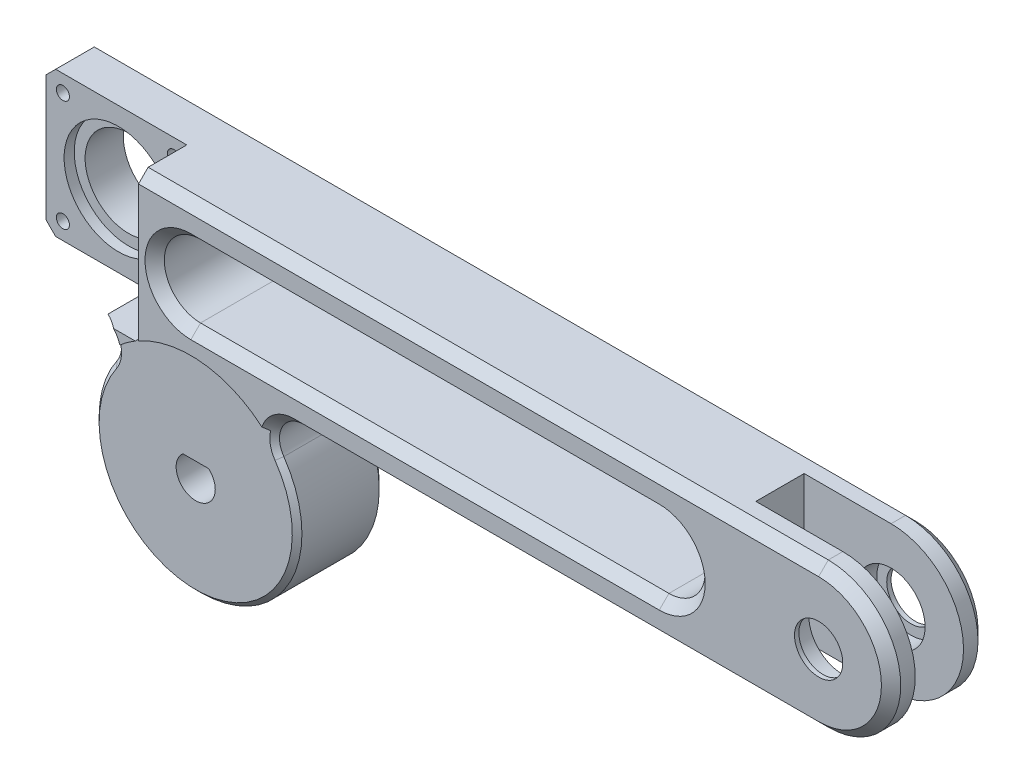
from build123d import *

# Parameters (mm, degrees)
EXTRUDE_1_DEPTH      = 20
CHAMFER_1_SIZE       = 2
SKETCH_5_R           = 5
CUT_EXTRUDE_4_DEPTH  = 5
SKETCH_3_W           = 36
SKETCH_3_H           = 10
CUT_EXTRUDE_2_DEPTH  = 200.103917213
CUT_EXTRUDE_3_DEPTH  = 195.273950902
CHAMFER_2_SIZE       = 2
CHAMFER_3_SIZE       = 2
CHAMFER_4_SIZE       = 2
CUT_EXTRUDE_START    = -20
SKETCH_8_W           = 28.3
SKETCH_8_H           = 31
CUT_EXTRUDE_5_DEPTH  = 10
SKETCH_9_R           = 11.25
CUT_EXTRUDE_6_DEPTH  = 2.1
SKETCH_9_3_R         = 1.35
CUT_EXTRUDE_7_DEPTH  = 194.500304907
CUT_EXTRUDE_8_DEPTH  = 195.273950902
SKETCH_11_W          = 21.182127439
SKETCH_11_H          = 11.878785241
CUT_EXTRUDE_9_DEPTH  = 200.103917213
SKETCH_12_R          = 9
CUT_EXTRUDE_10_DEPTH = 194.62019006
SKETCH_13_R          = 7.05
CUT_EXTRUDE_11_DEPTH = 4.1
SKETCH_14_R          = 22.5
CUT_EXTRUDE_12_DEPTH = 1


with BuildPart() as part:
    # 草图1 → 凸台-拉伸1 (new body)
    with BuildSketch(Plane.XY):
        with BuildLine():
            Line((0, 15), (170, 15))
            ThreePointArc((170, 15), (185, 0), (170, -15))
            Line((170, -15), (61.353463239, -15))
            ThreePointArc((61.353463239, -15), (56.922725161, -17.682984659), (57.247028001, -22.852575965))
            ThreePointArc((57.247028001, -22.852575965), (40, -55.833395016), (22.752971999, -22.852575965))
            ThreePointArc((22.752971999, -22.852575965), (23.077274839, -17.682984659), (18.646536761, -15))
            Line((18.646536761, -15), (0, -15))
            Line((0, -15), (0, 15))
        make_face()
    extrude(amount=EXTRUDE_1_DEPTH)

    # 倒角1
    chamfer_1_edges = [part.edges().sort_by_distance(p)[0] for p in [
        (0, -15, 10),
        (0, 15, 10),
    ]]
    chamfer(chamfer_1_edges, length=CHAMFER_1_SIZE)

    # 草图5 → 切除-拉伸4 (cut)
    with BuildSketch(Plane(origin=(0, 0, 0), x_dir=(-1, 0, 0), z_dir=(0, 0, -1))):
        with Locations((-170, 0)):
            Circle(SKETCH_5_R)
    cut_extrude_4 = extrude(amount=-CUT_EXTRUDE_4_DEPTH, mode=Mode.SUBTRACT)

    # 草图3 → 切除-拉伸2 (cut, through all)
    with BuildSketch(Plane(origin=(0, 15, 0), x_dir=(1, 0, 0), z_dir=(0, 1, 0))):
        with Locations((170, -10)):
            Rectangle(SKETCH_3_W, SKETCH_3_H)
    extrude(amount=-CUT_EXTRUDE_2_DEPTH, mode=Mode.SUBTRACT)

    # 草图4 → 切除-拉伸3 (cut, through all)
    with BuildSketch(Plane(origin=(0, 0, 0), x_dir=(-1, 0, 0), z_dir=(0, 0, -1))):
        with BuildLine():
            Line((-40, -7.5), (-137, -7.5))
            ThreePointArc((-137, -7.5), (-144.5, 0), (-137, 7.5))
            Line((-137, 7.5), (-40, 7.5))
            ThreePointArc((-40, 7.5), (-32.5, 0), (-40, -7.5))
        make_face()
    extrude(amount=-CUT_EXTRUDE_3_DEPTH, mode=Mode.SUBTRACT)

    # 倒角2
    chamfer_2_edges = [part.edges().sort_by_distance(p)[0] for p in [
        (32.5, 0, 20),
        (88.5, -7.5, 20),
        (144.5, 0, 20),
        (88.5, 7.5, 20),
        (32.5, 0, 0),
        (88.5, 7.5, 0),
        (144.5, 0, 0),
        (88.5, -7.5, 0),
    ]]
    chamfer(chamfer_2_edges, length=CHAMFER_2_SIZE)

    # 倒角3
    chamfer_3_edges = [part.edges().sort_by_distance(p)[0] for p in [
        (10.323268381, -15, 0),
        (23.077274839, -17.682984659, 0),
        (40, -55.833395016, 0),
        (56.922725161, -17.682984659, 0),
        (115.676731619, -15, 0),
        (185, 0, 0),
        (86, 15, 0),
    ]]
    chamfer(chamfer_3_edges, length=CHAMFER_3_SIZE)

    # 倒角4
    chamfer_4_edges = [part.edges().sort_by_distance(p)[0] for p in [
        (10.323268381, -15, 20),
        (23.077274839, -17.682984659, 20),
        (40, -55.833395016, 20),
        (56.922725161, -17.682984659, 20),
        (115.676731619, -15, 20),
        (185, 0, 20),
        (86, 15, 20),
    ]]
    chamfer(chamfer_4_edges, length=CHAMFER_4_SIZE)

    # 镜向1: 切除-拉伸4 across plane
    add(cut_extrude_4.mirror(Plane(origin=(0, 0, 10), x_dir=(1, 0, 0), z_dir=(0, 0, -1))), mode=Mode.SUBTRACT)

    # 草图8 → 切除-拉伸5 (cut)
    with BuildSketch(Plane(origin=(0, 0, 0), x_dir=(-1, 0, 0), z_dir=(0, 0, -1)).offset(CUT_EXTRUDE_START)):
        with Locations((-15, 0)):
            Rectangle(SKETCH_8_W, SKETCH_8_H)
    extrude(amount=CUT_EXTRUDE_5_DEPTH, mode=Mode.SUBTRACT)

    # 草图9 → 切除-拉伸6 (cut)
    with BuildSketch(Plane.XY.offset(10)):
        with Locations((15, 0)):
            Circle(SKETCH_9_R)
    extrude(amount=-CUT_EXTRUDE_6_DEPTH, mode=Mode.SUBTRACT)

    # 草图9<3> → 切除-拉伸7 (cut, through all)
    with BuildSketch(Plane.XY.offset(10)):
        with Locations((26.5, 11.5)):
            Circle(SKETCH_9_3_R)
        with Locations((3.5, 11.5)):
            Circle(SKETCH_9_3_R)
        with Locations((3.5, -11.5)):
            Circle(SKETCH_9_3_R)
        with Locations((26.5, -11.5)):
            Circle(SKETCH_9_3_R)
    extrude(amount=-CUT_EXTRUDE_7_DEPTH, mode=Mode.SUBTRACT)

    # 草图10 → 切除-拉伸8 (cut, through all)
    with BuildSketch(Plane.XY.offset(20)):
        with BuildLine():
            Line((42.664582519, -31.783395016), (37.335417481, -31.783395016))
            ThreePointArc((37.335417481, -31.783395016), (38.32504615, -38.520810046), (44.05, -34.833395016))
            ThreePointArc((44.05, -34.833395016), (43.68741503, -33.158441166), (42.664582519, -31.783395016))
        make_face()
    extrude(amount=-CUT_EXTRUDE_8_DEPTH, mode=Mode.SUBTRACT)

    # 草图11 → 切除-拉伸9 (cut, through all)
    with BuildSketch(Plane(origin=(0, 15, 0), x_dir=(1, 0, 0), z_dir=(0, 1, 0))):
        with Locations((1.235913402, -15.939392621)):
            Rectangle(SKETCH_11_W, SKETCH_11_H)
    extrude(amount=-CUT_EXTRUDE_9_DEPTH, mode=Mode.SUBTRACT)

    # 草图12 → 切除-拉伸10 (cut, through all)
    with BuildSketch(Plane.XY.offset(7.9)):
        with Locations((15, 0)):
            Circle(SKETCH_12_R)
    extrude(amount=-CUT_EXTRUDE_10_DEPTH, mode=Mode.SUBTRACT)

    # 草图13 → 切除-拉伸11 (cut)
    with BuildSketch(Plane(origin=(0, 0, 15), x_dir=(-1, 0, 0), z_dir=(0, 0, -1))):
        with Locations((-170, 0)):
            Circle(SKETCH_13_R)
    cut_extrude_11 = extrude(amount=-CUT_EXTRUDE_11_DEPTH, mode=Mode.SUBTRACT)

    # 镜向2: 切除-拉伸11 across plane
    add(cut_extrude_11.mirror(Plane(origin=(0, 0, 10), x_dir=(1, 0, 0), z_dir=(0, 0, -1))), mode=Mode.SUBTRACT)

    # 草图14 → 切除-拉伸12 (cut)
    with BuildSketch(Plane.XY.offset(20)):
        with Locations((40, -34.833395016)):
            Circle(SKETCH_14_R)
    cut_extrude_12 = extrude(amount=-CUT_EXTRUDE_12_DEPTH, mode=Mode.SUBTRACT)

    # 镜向3: 切除-拉伸12 across plane
    add(cut_extrude_12.mirror(Plane(origin=(0, 0, 10), x_dir=(1, 0, 0), z_dir=(0, 0, -1))), mode=Mode.SUBTRACT)


solid = part.part
